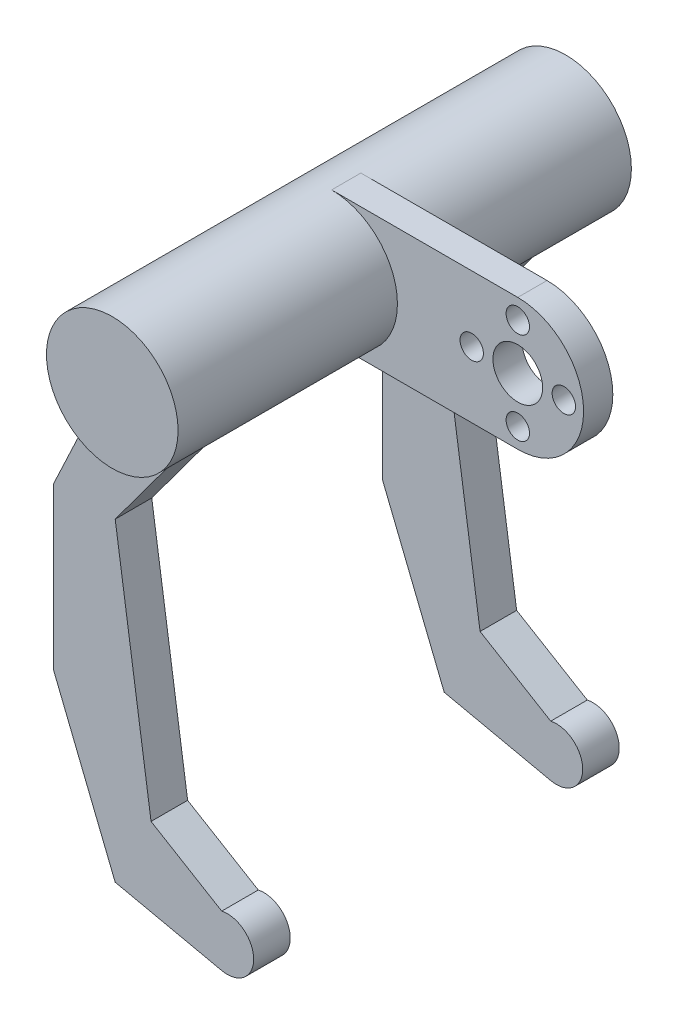
from build123d import *

# Parameters (mm, degrees)
SKETCH2_R                = 11.43
BOSS_EXTRUDE1_DEPTH      = 5.08
BOSS_EXTRUDE2_DEPTH      = 5.08
SKETCH4_R                = 4.318
SKETCH4_R_2              = 2.032
CUT_EXTRUDE1_DEPTH       = 5.08
CIRPATTERN1_COUNT        = 4
BOSS_EXTRUDE3_DEPTH      = 38.1
BOSS_EXTRUDE3_DEPTH_BACK = 40.64
SKETCH9_R                = 11.43
BOSS_EXTRUDE4_DEPTH      = 6.35


with BuildPart() as part:
    # Sketch2 → Boss-Extrude1 (new body)
    with BuildSketch(Plane.XY):
        Circle(SKETCH2_R)
    extrude(amount=BOSS_EXTRUDE1_DEPTH)

    # Sketch7 → Boss-Extrude2 (add)
    with BuildSketch(Plane(origin=(0, 0, 0), x_dir=(-1, 0, 0), z_dir=(0, 0, -1))):
        with BuildLine():
            Line((0, 11.43), (32.334928423, 11.43))
            ThreePointArc((32.334928423, 11.43), (43.764928423, 0), (32.334928423, -11.43))
            Line((32.334928423, -11.43), (0, -11.43))
            Line((0, -11.43), (0, 11.43))
        make_face()
    extrude(amount=-BOSS_EXTRUDE2_DEPTH)

    # Sketch4 → Cut-Extrude1 (cut)
    with BuildSketch(Plane(origin=(0, 0, 0), x_dir=(-1, 0, 0), z_dir=(0, 0, -1))):
        Circle(SKETCH4_R)
        with Locations((0, -8.001)):
            Circle(SKETCH4_R_2)
    cut_extrude1 = extrude(amount=-CUT_EXTRUDE1_DEPTH, mode=Mode.SUBTRACT)

    # CirPattern1: Cut-Extrude1 ×4 about axis
    cirpattern1_axis = Axis((0, 0, 0), (0, 0, 1))
    for i in range(1, CIRPATTERN1_COUNT):
        add(cut_extrude1.rotate(cirpattern1_axis, i * 360 / CIRPATTERN1_COUNT), mode=Mode.SUBTRACT)

    # Sketch9 → Boss-Extrude3 (add, two sides: drawn at the far end of the back side and taken through both)
    with BuildSketch(Plane.XY.offset(5.08).offset(-BOSS_EXTRUDE3_DEPTH_BACK)):
        with Locations((-32.334928423, 0)):
            Circle(SKETCH9_R)
    extrude(amount=BOSS_EXTRUDE3_DEPTH + BOSS_EXTRUDE3_DEPTH_BACK)

    # Sketch10 → Boss-Extrude4 (add)
    with BuildSketch(Plane.XY.offset(-31.75)):
        with BuildLine():
            Line((-37.028733454, -72.582202646), (-43.258278065, -30.219589225))
            Line((-43.258278065, -30.219589225), (-20.904928423, 0))
            Line((-20.904928423, 0), (-32.171436877, 0.015474968))
            Line((-32.171436877, 0.015474968), (-39.730825163, 0.025858069))
            Line((-39.730825163, 0.025858069), (-53.950343023, -30.219589225))
            Line((-53.950343023, -30.219589225), (-53.950343023, -58.308345581))
            Line((-53.950343023, -58.308345581), (-43.258278065, -84.842076202))
            Line((-43.258278065, -84.842076202), (-24.756596451, -88.874141931))
            ThreePointArc((-24.756596451, -88.874141931), (-19.207535115, -84.404142538), (-24.756596451, -79.934143145))
            Line((-24.756596451, -79.934143145), (-37.028733454, -72.582202646))
        make_face()
    boss_extrude4 = extrude(amount=BOSS_EXTRUDE4_DEPTH)

    # Mirror1: Boss-Extrude4 across plane
    add(boss_extrude4.mirror(Plane.XY))


solid = part.part
